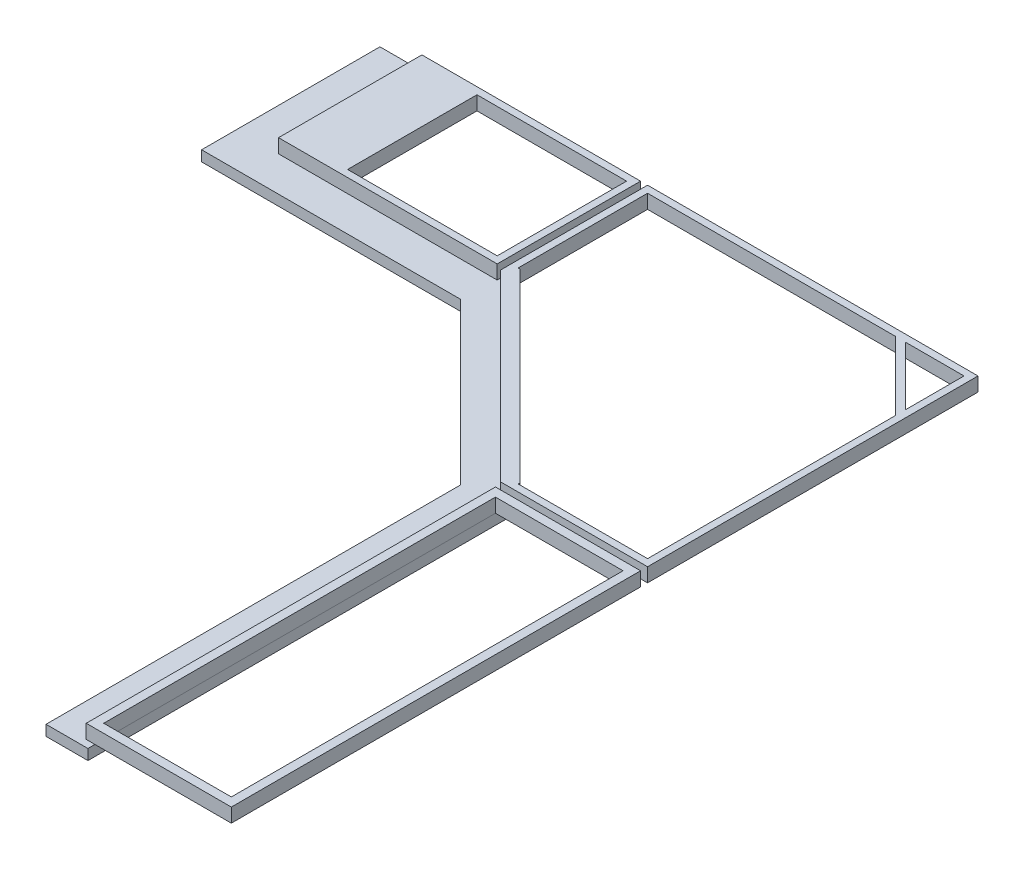
from build123d import *

# Parameters (mm, degrees)
MOULDING_DEPTH        = 19.05
BOSS_EXTRUDE4_DEPTH   = 25.4
SKETCH2_W             = 397.08460454
SKETCH2_H             = 260.364767801
SKETCH2_W_2           = 271.67210454
SKETCH2_H_2           = 234.964767801
BOSS_EXTRUDE4_2_DEPTH = 25.4
SKETCH2_W_3           = 263.525
SKETCH2_H_3           = 743.15960454
SKETCH2_W_4           = 231.775
SKETCH2_H_4           = 711.40960454
BOSS_EXTRUDE4_3_DEPTH = 25.4


with BuildPart() as part:
    # Sketch1 → Moulding (new body)
    with BuildSketch(Plane(origin=(0, 0, 0), x_dir=(1, 0, 0), z_dir=(0, 1, 0))):
        Polygon((-336.75960454, 0), (0, -336.75960454), (0, -1120.98460454), (-76.2, -1120.98460454), (-76.2, -368.322677993), (-368.322677993, -76.2), (-838.40960454, -76.2), (-838.40960454, 247.65), (-762.20960454, 247.65), (-762.20960454, 0), align=None)
    extrude(amount=MOULDING_DEPTH)


with BuildPart() as body_2:
    # Sketch2 → Boss-Extrude4 (new body)
    with BuildSketch(Plane(origin=(0, 19.05, 0), x_dir=(1, 0, 0), z_dir=(0, 1, 0))):
        Polygon((-352.425, 247.65), (-352.425, -19.372479083), (-19.372479083, -352.425), (247.65, -352.425), (247.65, 247.65), align=None)
        Polygon((-339.725, 0), (-339.725, 234.95), (110.796254172, 234.95), (234.95, 110.796254172), (234.95, -339.725), (0, -339.725), (0, -336.75960454), (-336.75960454, 0), align=None, mode=Mode.SUBTRACT)
        Polygon((128.756766414, 234.95), (234.95, 234.95), (234.95, 128.756766414), align=None, mode=Mode.SUBTRACT)
    extrude(amount=BOSS_EXTRUDE4_DEPTH)


with BuildPart() as body_3:
    # Sketch2 → Boss-Extrude4 2 (new body)
    with BuildSketch(Plane(origin=(0, 19.05, 0), x_dir=(1, 0, 0), z_dir=(0, 1, 0))):
        with Locations((-563.66730227, 117.4676161)):
            Rectangle(SKETCH2_W, SKETCH2_H)
        with Locations((-513.66105227, 117.4676161)):
            Rectangle(SKETCH2_W_2, SKETCH2_H_2, mode=Mode.SUBTRACT)
    extrude(amount=BOSS_EXTRUDE4_2_DEPTH)


with BuildPart() as body_4:
    # Sketch2 → Boss-Extrude4 3 (new body)
    with BuildSketch(Plane(origin=(0, 19.05, 0), x_dir=(1, 0, 0), z_dir=(0, 1, 0))):
        with Locations((115.8875, -736.70480227)):
            Rectangle(SKETCH2_W_3, SKETCH2_H_3)
        with Locations((115.8875, -736.70480227)):
            Rectangle(SKETCH2_W_4, SKETCH2_H_4, mode=Mode.SUBTRACT)
    extrude(amount=BOSS_EXTRUDE4_3_DEPTH)


solid = Compound([part.part, body_2.part, body_3.part, body_4.part])
